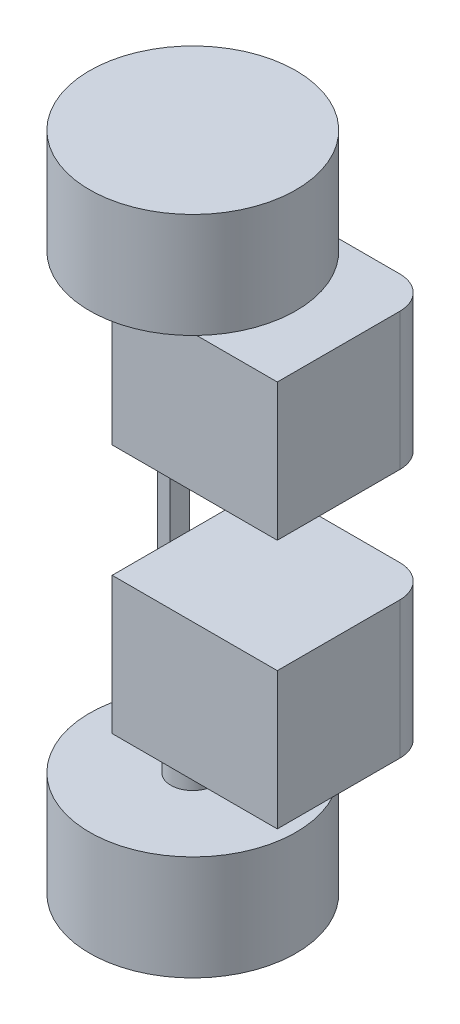
from build123d import *

# Parameters (mm, degrees)
SKETCH_1_W          = 51.2
SKETCH_1_H          = 48
EXTRUDE_1_DEPTH     = 120
FILLET_1_R          = 10
SKETCH_3_R          = 6.803864169
EXTRUDE_2_DEPTH     = 10
SKETCH_4_R          = 32
EXTRUDE_3_DEPTH     = 32.5
SKETCH_5_W          = 48
SKETCH_5_H          = 35
CUT_EXTRUDE_1_DEPTH = 178.007598707
SKETCH_6_W          = 6
SKETCH_6_H          = 120
EXTRUDE_6_DEPTH     = 4


with BuildPart() as part:
    # 草图1 → 凸台-拉伸1 (new body)
    with BuildSketch(Plane(origin=(0, 0, 0), x_dir=(1, 0, 0), z_dir=(0, 1, 0))):
        with Locations((25.6, 24)):
            Rectangle(SKETCH_1_W, SKETCH_1_H)
    extrude(amount=EXTRUDE_1_DEPTH)

    # 圆角1
    fillet_1_edges = [part.edges().sort_by_distance(p)[0] for p in [
        (51.2, 60, -48),
    ]]
    fillet(fillet_1_edges, radius=FILLET_1_R)

    # 草图3 → 凸台-拉伸2 (add)
    with BuildSketch(Plane.XZ):
        with Locations(Location((13, -12, 0), (0, 0, 270))):
            Circle(SKETCH_3_R)
    extrude_2 = extrude(amount=EXTRUDE_2_DEPTH)

    # 草图4 → 凸台-拉伸3 (add)
    with BuildSketch(Plane.XZ.offset(10)):
        with Locations(Location((13, -12, 0), (0, 0, 270))):
            Circle(SKETCH_4_R)
    extrude_3 = extrude(amount=EXTRUDE_3_DEPTH)

    # 镜向1: 凸台-拉伸2, 凸台-拉伸3 across plane
    add(extrude_2.mirror(Plane(origin=(0, 60, 0), x_dir=(0, 0, 1), z_dir=(0, -1, 0))))
    add(extrude_3.mirror(Plane(origin=(0, 60, 0), x_dir=(0, 0, 1), z_dir=(0, -1, 0))))

    # 草图5 → 切除-拉伸1 (cut, through all)
    with BuildSketch(Plane.ZY):
        with Locations((-24, 60)):
            Rectangle(SKETCH_5_W, SKETCH_5_H)
    extrude(amount=-CUT_EXTRUDE_1_DEPTH, mode=Mode.SUBTRACT)


with BuildPart() as cut_extrude_1_piece_1:
    # of the separate pieces the step leaves, piece 1, a body of its own (cut_extrude_1_pieces)
    add(part.part.solids().sort_by_distance((13, 130, -44))[0])



with BuildPart() as cut_extrude_1_piece_2:
    # of the separate pieces the step leaves, piece 2, a body of its own (cut_extrude_1_pieces)
    add(part.part.solids().sort_by_distance((51.2, 0, -38))[0])


with BuildPart() as cut_extrude_1_piece_1_1:
    add(cut_extrude_1_piece_1.part)

    add(cut_extrude_1_piece_2.part)  # 凸台-拉伸6 merges 切除-拉伸1 piece 2
    # 草图6 → 凸台-拉伸6 (add)
    with BuildSketch(Plane.ZY):
        with Locations((-21, 60)):
            Rectangle(SKETCH_6_W, SKETCH_6_H)
    extrude(amount=EXTRUDE_6_DEPTH)


solid = cut_extrude_1_piece_1_1.part
